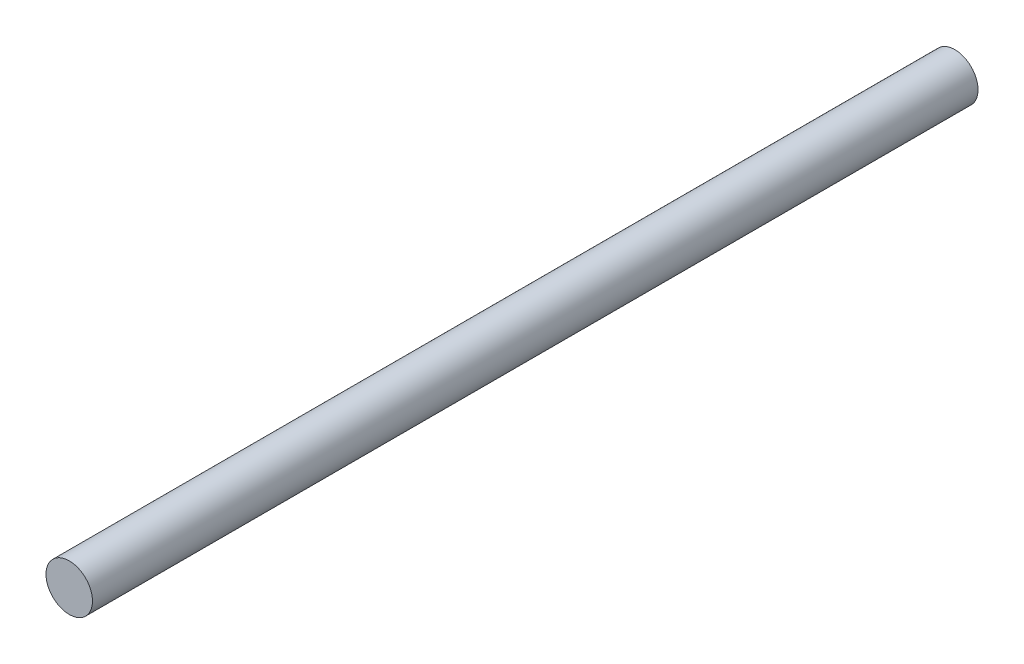
from build123d import *

# Parameters (mm, degrees)
SKETCH3_R           = 4
BOSS_EXTRUDE1_DEPTH = 152.4


with BuildPart() as part:
    # Sketch3 → Boss-Extrude1 (new body)
    with BuildSketch(Plane.XY):
        with Locations(Location((0, 0, 0), (0, 0, 180))):
            Circle(SKETCH3_R)
    extrude(amount=BOSS_EXTRUDE1_DEPTH)


solid = part.part
